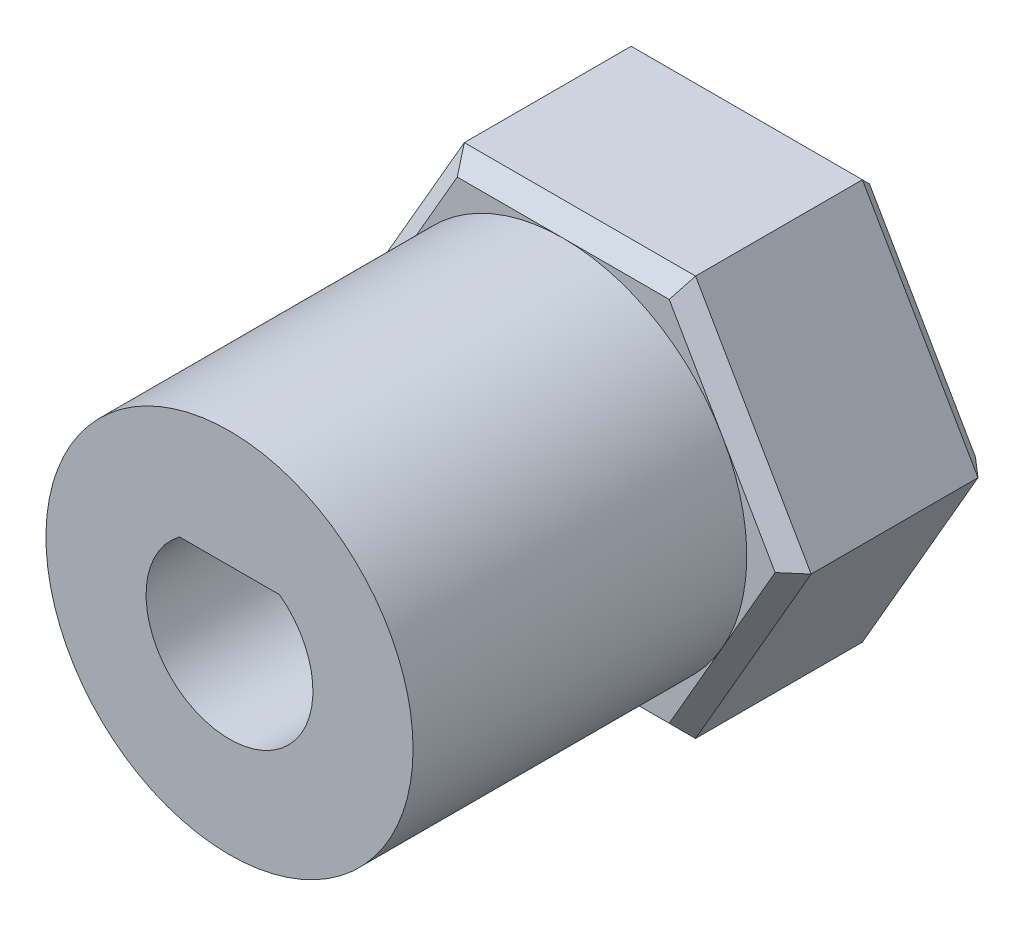
from build123d import *

# Parameters (mm, degrees)
SKETCH_1_R      = 1.75
EXTRUDE_1_DEPTH = 6
CHAMFER_1_SIZE  = 0.5
SKETCH_2_R      = 5.5
EXTRUDE_2_DEPTH = 10


with BuildPart() as part:
    # 草图1 → 凸台-拉伸1 (new body)
    with BuildSketch(Plane.XY):
        Polygon((3.464101615, 6), (-3.464101615, 6), (-6.92820323, 0), (-3.464101615, -6), (3.464101615, -6), (6.92820323, 0), align=None)
        Circle(SKETCH_1_R, mode=Mode.SUBTRACT)
    extrude(amount=EXTRUDE_1_DEPTH)

    # 倒角1
    chamfer_1_edges = [part.edges().sort_by_distance(p)[0] for p in [
        (-5.196152423, 3, 6),
        (-5.196152423, -3, 6),
        (0, -6, 6),
        (5.196152423, -3, 6),
        (5.196152423, 3, 6),
        (5.196152423, -3, 0),
        (0, -6, 0),
        (-5.196152423, -3, 0),
        (-5.196152423, 3, 0),
        (0, 6, 0),
        (5.196152423, 3, 0),
        (0, 6, 6),
    ]]
    chamfer(chamfer_1_edges, length=CHAMFER_1_SIZE)

    # 草图2 → 凸台-拉伸2 (add)
    with BuildSketch(Plane.XY.offset(6)):
        with Locations(Location((0, 0, 0), (0, 0, 150))):
            Circle(SKETCH_2_R)
        with BuildLine():
            Line((-1.5, 2), (1.5, 2))
            ThreePointArc((1.5, 2), (0, -2.5), (-1.5, 2))
        make_face(mode=Mode.SUBTRACT)
    extrude(amount=EXTRUDE_2_DEPTH)


solid = part.part
